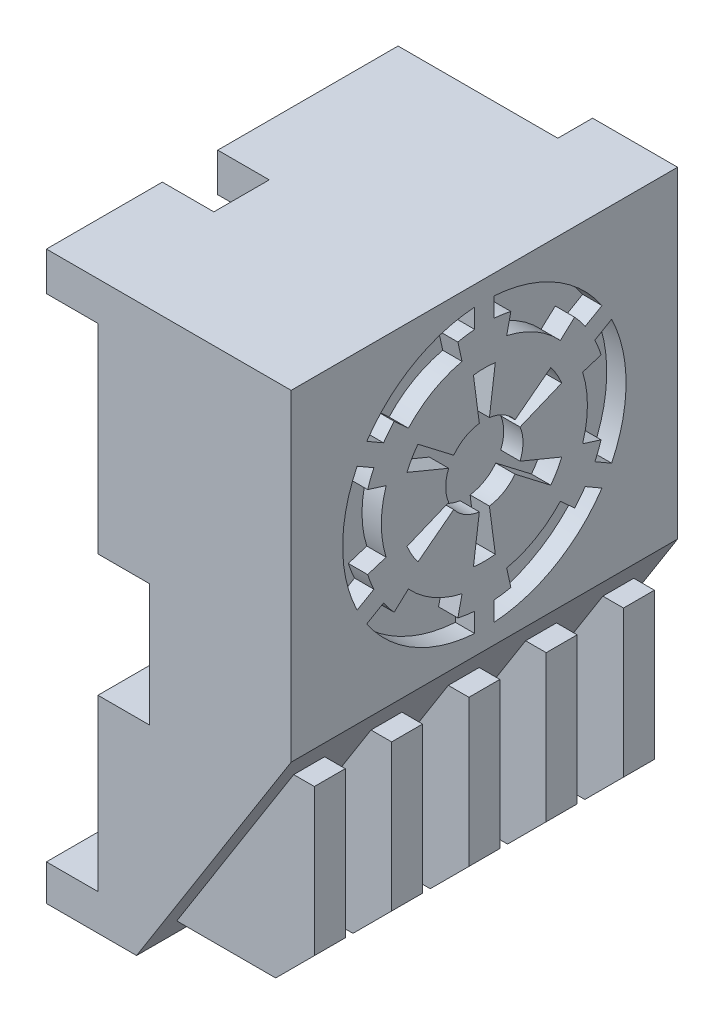
from build123d import *

# Parameters (mm, degrees)
SKETCH1_W           = 30
SKETCH1_H           = 25
BOSS_EXTRUDE1_DEPTH = 3
SKETCH2_W           = 9
SKETCH2_H           = 3
SKETCH2_W_2         = 14
BOSS_EXTRUDE2_DEPTH = 16
SKETCH3_W           = 4.3
SKETCH3_H           = 3
BOSS_EXTRUDE3_DEPTH = 12
SKETCH4_W           = 30
SKETCH4_H           = 5.5
BOSS_EXTRUDE4_DEPTH = 8
BOSS_EXTRUDE5_DEPTH = 30
SKETCH7_W           = 4
SKETCH7_H           = 9
SKETCH7_H_2         = 16.7
BOSS_EXTRUDE6_DEPTH = 3
SKETCH9_W           = 12
SKETCH9_H           = 16.5
BOSS_EXTRUDE7_DEPTH = 2
BOSS_EXTRUDE8_REACH = 41.727
SKETCH11_W          = 2.4
SKETCH11_H          = 14.373311352
CHAMFER1_SIZE       = 3
SKETCH12_R          = 3
CUT_EXTRUDE1_DEPTH  = 1.5
SKETCH13_W          = 2.7
SKETCH13_H          = 19.5
BOSS_EXTRUDE9_DEPTH = 3.6
SKETCH14_W          = 4
SKETCH14_H          = 1
SKETCH14_H_2        = 0.2
CUT_EXTRUDE2_DEPTH  = 47.349217901


with BuildPart() as part:
    # Sketch1 → Boss-Extrude1 (new body)
    with BuildSketch(Plane(origin=(0, 0, 0), x_dir=(0, 0, -1), z_dir=(1, 0, 0))):
        Rectangle(SKETCH1_W, SKETCH1_H)
    extrude(amount=BOSS_EXTRUDE1_DEPTH)

    # Sketch2 → Boss-Extrude2 (add)
    with BuildSketch(Plane.ZY):
        with Locations((10.5, 11)):
            Rectangle(SKETCH2_W, SKETCH2_H)
        with Locations((-5.3, 11)):
            Rectangle(SKETCH2_W_2, SKETCH2_H)
    extrude(amount=BOSS_EXTRUDE2_DEPTH)

    # Sketch3 → Boss-Extrude3 (add)
    with BuildSketch(Plane.ZY):
        with Locations((3.85, 11)):
            Rectangle(SKETCH3_W, SKETCH3_H)
    extrude(amount=BOSS_EXTRUDE3_DEPTH)

    # Sketch4 → Boss-Extrude4 (add)
    with BuildSketch(Plane.ZY):
        with Locations((0, -9.75)):
            Rectangle(SKETCH4_W, SKETCH4_H)
    extrude(amount=BOSS_EXTRUDE4_DEPTH)

    # Sketch5 → Boss-Extrude5 (add)
    with BuildSketch(Plane.XY.offset(15)):
        Polygon((-12, -31.5), (-9, -31.5), (3, -12.5), (-8, -12.5), (-8, -15.5), (-12, -15.5), align=None)
    extrude(amount=-BOSS_EXTRUDE5_DEPTH)

    # Sketch7 → Boss-Extrude6 (add)
    with BuildSketch(Plane.XZ.offset(31.5)):
        with Locations((-14, 10.5)):
            Rectangle(SKETCH7_W, SKETCH7_H)
        with Locations((-14, -6.65)):
            Rectangle(SKETCH7_W, SKETCH7_H_2)
    extrude(amount=-BOSS_EXTRUDE6_DEPTH)

    # Sketch9 → Boss-Extrude7 (add)
    with BuildSketch(Plane.XY.offset(15)):
        with Locations((-6, 1.25)):
            Rectangle(SKETCH9_W, SKETCH9_H)
    extrude(amount=-BOSS_EXTRUDE7_DEPTH)

    # Boss-Extrude8: up to this plane
    boss_extrude8_end = Plane(origin=(-9, -31.5, -39.207436874), z_dir=(0.8454889030309711, -0.5339929913879816, 0))
    # Sketch11 → Boss-Extrude8 (add, up to the surface)
    with BuildSketch(Plane(origin=(3, 0, 0), x_dir=(0, 0, -1), z_dir=(1, 0, 0)), mode=Mode.PRIVATE) as boss_extrude8_sk1:
        with Locations((-12, -22.223122385)):
            Rectangle(SKETCH11_W, SKETCH11_H)
    boss_extrude8_tool1 = split(extrude(boss_extrude8_sk1.sketch, amount=-BOSS_EXTRUDE8_REACH, mode=Mode.PRIVATE), bisect_by=boss_extrude8_end, keep=Keep.BOTH, mode=Mode.PRIVATE)
    add(boss_extrude8_tool1.solids().sort_by_distance((3, -22.223122, 12))[0])
    # Sketch11 → Boss-Extrude8 (add, up to the surface)
    with BuildSketch(Plane(origin=(3, 0, 0), x_dir=(0, 0, -1), z_dir=(1, 0, 0)), mode=Mode.PRIVATE) as boss_extrude8_sk2:
        with Locations((-6, -22.223122385)):
            Rectangle(SKETCH11_W, SKETCH11_H)
    boss_extrude8_tool2 = split(extrude(boss_extrude8_sk2.sketch, amount=-BOSS_EXTRUDE8_REACH, mode=Mode.PRIVATE), bisect_by=boss_extrude8_end, keep=Keep.BOTH, mode=Mode.PRIVATE)
    add(boss_extrude8_tool2.solids().sort_by_distance((3, -22.223122, 6))[0])
    # Sketch11 → Boss-Extrude8 (add, up to the surface)
    with BuildSketch(Plane(origin=(3, 0, 0), x_dir=(0, 0, -1), z_dir=(1, 0, 0)), mode=Mode.PRIVATE) as boss_extrude8_sk3:
        with Locations((0, -22.223122385)):
            Rectangle(SKETCH11_W, SKETCH11_H)
    boss_extrude8_tool3 = split(extrude(boss_extrude8_sk3.sketch, amount=-BOSS_EXTRUDE8_REACH, mode=Mode.PRIVATE), bisect_by=boss_extrude8_end, keep=Keep.BOTH, mode=Mode.PRIVATE)
    add(boss_extrude8_tool3.solids().sort_by_distance((3, -22.223122, 0))[0])
    # Sketch11 → Boss-Extrude8 (add, up to the surface)
    with BuildSketch(Plane(origin=(3, 0, 0), x_dir=(0, 0, -1), z_dir=(1, 0, 0)), mode=Mode.PRIVATE) as boss_extrude8_sk4:
        with Locations((6, -22.223122385)):
            Rectangle(SKETCH11_W, SKETCH11_H)
    boss_extrude8_tool4 = split(extrude(boss_extrude8_sk4.sketch, amount=-BOSS_EXTRUDE8_REACH, mode=Mode.PRIVATE), bisect_by=boss_extrude8_end, keep=Keep.BOTH, mode=Mode.PRIVATE)
    add(boss_extrude8_tool4.solids().sort_by_distance((3, -22.223122, -6))[0])
    # Sketch11 → Boss-Extrude8 (add, up to the surface)
    with BuildSketch(Plane(origin=(3, 0, 0), x_dir=(0, 0, -1), z_dir=(1, 0, 0)), mode=Mode.PRIVATE) as boss_extrude8_sk5:
        with Locations((12, -22.223122385)):
            Rectangle(SKETCH11_W, SKETCH11_H)
    boss_extrude8_tool5 = split(extrude(boss_extrude8_sk5.sketch, amount=-BOSS_EXTRUDE8_REACH, mode=Mode.PRIVATE), bisect_by=boss_extrude8_end, keep=Keep.BOTH, mode=Mode.PRIVATE)
    add(boss_extrude8_tool5.solids().sort_by_distance((3, -22.223122, -12))[0])

    # Chamfer1
    chamfer1_edges = [part.edges().sort_by_distance(p)[0] for p in [
        (3, -29.409778061, 12),
        (3, -29.409778061, 6),
        (3, -29.409778061, 0),
        (3, -29.409778061, -6),
        (3, -29.409778061, -12),
    ]]
    chamfer(chamfer1_edges, length=CHAMFER1_SIZE)

    # Sketch12 → Cut-Extrude1 (cut)
    with BuildSketch(Plane(origin=(3, 0, 0), x_dir=(0, 0, -1), z_dir=(1, 0, 0))):
        with BuildLine():
            Line((-0.75, 9.470348462), (-0.75, 10.974402034))
            ThreePointArc((-0.75, 10.974402034), (-5.5, 9.526279442), (-9.129110953, 6.13672007))
            Line((-9.129110953, 6.13672007), (-7.826562351, 5.384693284))
            ThreePointArc((-7.826562351, 5.384693284), (-7.433328979, 5.915709618), (-7.0041347, 6.418106972))
            ThreePointArc((-7.0041347, 6.418106972), (-4.75, 8.227241336), (-2.056176332, 9.274812068))
            ThreePointArc((-2.056176332, 9.274812068), (-1.406490321, 9.39530654), (-0.75, 9.470348462))
        make_face()
        with BuildLine():
            Line((-8.576562351, 4.085655178), (-9.879110953, 4.837681964))
            ThreePointArc((-9.879110953, 4.837681964), (-11, 0), (-9.879110953, -4.837681964))
            Line((-9.879110953, -4.837681964), (-8.576562351, -4.085655178))
            ThreePointArc((-8.576562351, -4.085655178), (-8.8398193, -3.479596922), (-9.060311032, -2.856705095))
            ThreePointArc((-9.060311032, -2.856705095), (-9.5, 0), (-9.060311032, 2.856705095))
            ThreePointArc((-9.060311032, 2.856705095), (-8.8398193, 3.479596922), (-8.576562351, 4.085655178))
        make_face()
        with BuildLine():
            Line((-7.826562351, -5.384693284), (-9.129110953, -6.13672007))
            ThreePointArc((-9.129110953, -6.13672007), (-5.5, -9.526279442), (-0.75, -10.974402034))
            Line((-0.75, -10.974402034), (-0.75, -9.470348462))
            ThreePointArc((-0.75, -9.470348462), (-1.406490321, -9.39530654), (-2.056176332, -9.274812068))
            ThreePointArc((-2.056176332, -9.274812068), (-4.75, -8.227241336), (-7.0041347, -6.418106972))
            ThreePointArc((-7.0041347, -6.418106972), (-7.433328979, -5.915709618), (-7.826562351, -5.384693284))
        make_face()
        with BuildLine():
            ThreePointArc((0.75, -10.974402034), (5.5, -9.526279442), (9.129110953, -6.13672007))
            Line((9.129110953, -6.13672007), (7.826562351, -5.384693284))
            ThreePointArc((7.826562351, -5.384693284), (7.433328979, -5.915709618), (7.0041347, -6.418106972))
            ThreePointArc((7.0041347, -6.418106972), (4.75, -8.227241336), (2.056176332, -9.274812068))
            ThreePointArc((2.056176332, -9.274812068), (1.406490321, -9.39530654), (0.75, -9.470348462))
            Line((0.75, -9.470348462), (0.75, -10.974402034))
        make_face()
        with BuildLine():
            ThreePointArc((11, 0), (10.716114512, 2.482919604), (9.879110953, 4.837681964))
            Line((9.879110953, 4.837681964), (8.576562351, 4.085655178))
            ThreePointArc((8.576562351, 4.085655178), (8.8398193, 3.479596922), (9.060311032, 2.856705095))
            ThreePointArc((9.060311032, 2.856705095), (9.389434349, 1.445172169), (9.5, 0))
            ThreePointArc((9.5, 0), (9.389434349, -1.445172169), (9.060311032, -2.856705095))
            ThreePointArc((9.060311032, -2.856705095), (8.8398193, -3.479596922), (8.576562351, -4.085655178))
            Line((8.576562351, -4.085655178), (9.879110953, -4.837681964))
            ThreePointArc((9.879110953, -4.837681964), (10.716114512, -2.482919604), (11, 0))
        make_face()
        with BuildLine():
            ThreePointArc((9.129110953, 6.13672007), (5.5, 9.526279442), (0.75, 10.974402034))
            Line((0.75, 10.974402034), (0.75, 9.470348462))
            ThreePointArc((0.75, 9.470348462), (1.406490321, 9.39530654), (2.056176332, 9.274812068))
            ThreePointArc((2.056176332, 9.274812068), (4.75, 8.227241336), (7.0041347, 6.418106972))
            ThreePointArc((7.0041347, 6.418106972), (7.433328979, 5.915709618), (7.826562351, 5.384693284))
            Line((7.826562351, 5.384693284), (9.129110953, 6.13672007))
        make_face()
        with BuildLine():
            Line((-1.731516912, 7.810368057), (-2.056176332, 9.274812068))
            ThreePointArc((-2.056176332, 9.274812068), (-4.75, 8.227241336), (-7.0041347, 6.418106972))
            Line((-7.0041347, 6.418106972), (-5.898218694, 5.404721661))
            ThreePointArc((-5.898218694, 5.404721661), (-4, 6.92820323), (-1.731516912, 7.810368057))
        make_face()
        with BuildLine():
            Line((-7.629735606, 2.405646396), (-9.060311032, 2.856705095))
            ThreePointArc((-9.060311032, 2.856705095), (-9.5, 0), (-9.060311032, -2.856705095))
            Line((-9.060311032, -2.856705095), (-7.629735606, -2.405646396))
            ThreePointArc((-7.629735606, -2.405646396), (-8, 0), (-7.629735606, 2.405646396))
        make_face()
        with BuildLine():
            Line((-5.898218694, -5.404721661), (-7.0041347, -6.418106972))
            ThreePointArc((-7.0041347, -6.418106972), (-4.75, -8.227241336), (-2.056176332, -9.274812068))
            Line((-2.056176332, -9.274812068), (-1.731516912, -7.810368057))
            ThreePointArc((-1.731516912, -7.810368057), (-4, -6.92820323), (-5.898218694, -5.404721661))
        make_face()
        with BuildLine():
            ThreePointArc((2.056176332, -9.274812068), (4.75, -8.227241336), (7.0041347, -6.418106972))
            Line((7.0041347, -6.418106972), (5.898218694, -5.404721661))
            ThreePointArc((5.898218694, -5.404721661), (4, -6.92820323), (1.731516912, -7.810368057))
            Line((1.731516912, -7.810368057), (2.056176332, -9.274812068))
        make_face()
        with BuildLine():
            ThreePointArc((9.5, 0), (9.389434349, 1.445172169), (9.060311032, 2.856705095))
            Line((9.060311032, 2.856705095), (7.629735606, 2.405646396))
            ThreePointArc((7.629735606, 2.405646396), (7.906892084, 1.21698709), (8, 0))
            ThreePointArc((8, 0), (7.906892084, -1.21698709), (7.629735606, -2.405646396))
            Line((7.629735606, -2.405646396), (9.060311032, -2.856705095))
            ThreePointArc((9.060311032, -2.856705095), (9.389434349, -1.445172169), (9.5, 0))
        make_face()
        with BuildLine():
            ThreePointArc((7.0041347, 6.418106972), (4.75, 8.227241336), (2.056176332, 9.274812068))
            Line((2.056176332, 9.274812068), (1.731516912, 7.810368057))
            ThreePointArc((1.731516912, 7.810368057), (4, 6.92820323), (5.898218694, 5.404721661))
            Line((5.898218694, 5.404721661), (7.0041347, 6.418106972))
        make_face()
        with BuildLine():
            Line((-2.380060021, 1.826284287), (-5.156796712, 3.956949289))
            ThreePointArc((-5.156796712, 3.956949289), (-5.629165125, 3.25), (-6.005216961, 2.48744231))
            Line((-6.005216961, 2.48744231), (-2.771638598, 1.148050297))
            ThreePointArc((-2.771638598, 1.148050297), (-2.598076211, 1.5), (-2.380060021, 1.826284287))
        make_face()
        with BuildLine():
            Line((-2.771638598, -1.148050297), (-6.005216961, -2.48744231))
            ThreePointArc((-6.005216961, -2.48744231), (-5.629165125, -3.25), (-5.156796712, -3.956949289))
            Line((-5.156796712, -3.956949289), (-2.380060021, -1.826284287))
            ThreePointArc((-2.380060021, -1.826284287), (-2.598076211, -1.5), (-2.771638598, -1.148050297))
        make_face()
        with BuildLine():
            Line((-0.391578577, -2.974334584), (-0.848420249, -6.444391599))
            ThreePointArc((-0.848420249, -6.444391599), (0, -6.5), (0.848420249, -6.444391599))
            Line((0.848420249, -6.444391599), (0.391578577, -2.974334584))
            ThreePointArc((0.391578577, -2.974334584), (0, -3), (-0.391578577, -2.974334584))
        make_face()
        with BuildLine():
            ThreePointArc((5.156796712, -3.956949289), (5.629165125, -3.25), (6.005216961, -2.48744231))
            Line((6.005216961, -2.48744231), (2.771638598, -1.148050297))
            ThreePointArc((2.771638598, -1.148050297), (2.598076211, -1.5), (2.380060021, -1.826284287))
            Line((2.380060021, -1.826284287), (5.156796712, -3.956949289))
        make_face()
        with BuildLine():
            ThreePointArc((6.005216961, 2.48744231), (5.629165125, 3.25), (5.156796712, 3.956949289))
            Line((5.156796712, 3.956949289), (2.380060021, 1.826284287))
            ThreePointArc((2.380060021, 1.826284287), (2.598076211, 1.5), (2.771638598, 1.148050297))
            Line((2.771638598, 1.148050297), (6.005216961, 2.48744231))
        make_face()
        with BuildLine():
            ThreePointArc((0.848420249, 6.444391599), (0, 6.5), (-0.848420249, 6.444391599))
            Line((-0.848420249, 6.444391599), (-0.391578577, 2.974334584))
            ThreePointArc((-0.391578577, 2.974334584), (0, 3), (0.391578577, 2.974334584))
            Line((0.391578577, 2.974334584), (0.848420249, 6.444391599))
        make_face()
        Circle(SKETCH12_R)
    extrude(amount=-CUT_EXTRUDE1_DEPTH, mode=Mode.SUBTRACT)

    # Sketch13 → Boss-Extrude9 (add)
    with BuildSketch(Plane.ZY):
        with Locations((-13.65, 2.75)):
            Rectangle(SKETCH13_W, SKETCH13_H)
    extrude(amount=BOSS_EXTRUDE9_DEPTH)

    # Sketch14 → Cut-Extrude2 (cut, through all)
    with BuildSketch(Plane.XY.offset(15)):
        with Locations((-10, -6.5)):
            Rectangle(SKETCH14_W, SKETCH14_H)
        with Locations((-14, -28.6)):
            Rectangle(SKETCH14_W, SKETCH14_H_2)
    extrude(amount=-CUT_EXTRUDE2_DEPTH, mode=Mode.SUBTRACT)


solid = part.part
